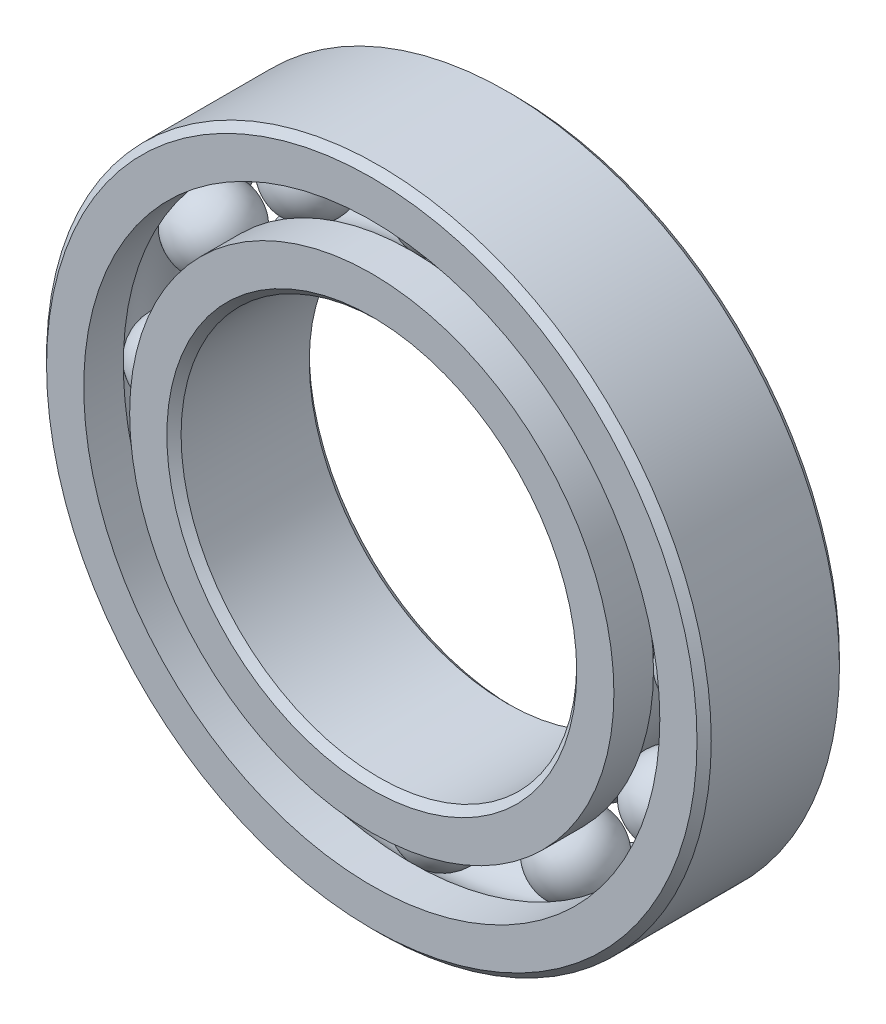
from build123d import *

# Parameters (mm, degrees)
CIRPATTERN1_COUNT = 12


with BuildPart() as part:
    # Sketch1 → Revolve1 (revolve)
    with BuildSketch(Plane(origin=(0, 0, 0), x_dir=(0, 0, -1), z_dir=(1, 0, 0))):
        with BuildLine():
            Line((4.05, 21), (-4.05, 21))
            Line((-4.05, 21), (-4.5, 20.55))
            Line((-4.5, 20.55), (-4.5, 18.200549451))
            Line((-4.5, 18.200549451), (-2, 18.200549451))
            ThreePointArc((-2, 18.200549451), (0, 19.220646415), (2, 18.200549451))
            Line((2, 18.200549451), (4.5, 18.200549451))
            Line((4.5, 18.200549451), (4.5, 20.55))
            Line((4.5, 20.55), (4.05, 21))
        make_face()
    revolve(axis=Axis((0, 0, 4.5), (0, 0, -1)))


with BuildPart() as body_2:
    # Sketch3 → Revolve3 (revolve)
    with BuildSketch(Plane(origin=(0, 0, 0), x_dir=(0, 0, -1), z_dir=(1, 0, 0))):
        with BuildLine():
            Line((-4.5, 15.299450549), (-2, 15.299450549))
            ThreePointArc((-2, 15.299450549), (0, 14.279353585), (2, 15.299450549))
            Line((2, 15.299450549), (4.5, 15.299450549))
            Line((4.5, 15.299450549), (4.5, 12.95))
            Line((4.5, 12.95), (4.05, 12.5))
            Line((4.05, 12.5), (-4.05, 12.5))
            Line((-4.05, 12.5), (-4.5, 12.95))
            Line((-4.5, 12.95), (-4.5, 15.299450549))
        make_face()
    revolve(axis=Axis((0, 0, 4.5), (0, 0, -1)))


with BuildPart() as body_3:
    # Sketch4 → Revolve4 (revolve)
    with BuildSketch(Plane(origin=(0, 0, 0), x_dir=(0, 0, -1), z_dir=(1, 0, 0))):
        with BuildLine():
            Line((-2.470646415, 16.75), (2.470646415, 16.75))
            ThreePointArc((2.470646415, 16.75), (0, 19.220646415), (-2.470646415, 16.75))
        make_face()
    revolve(axis=Axis((0, 16.75, 2.470646415), (0, 0, -1)))


with BuildPart() as cirpattern1_1:
    # CirPattern1: pattern copy
    add(body_3.part.rotate(Axis((0, 0, -4.5), (0, 0, 1)), 1 * 360 / CIRPATTERN1_COUNT))


with BuildPart() as cirpattern1_2:
    # CirPattern1: pattern copy
    add(body_3.part.rotate(Axis((0, 0, -4.5), (0, 0, 1)), 2 * 360 / CIRPATTERN1_COUNT))


with BuildPart() as cirpattern1_3:
    # CirPattern1: pattern copy
    add(body_3.part.rotate(Axis((0, 0, -4.5), (0, 0, 1)), 3 * 360 / CIRPATTERN1_COUNT))


with BuildPart() as cirpattern1_4:
    # CirPattern1: pattern copy
    add(body_3.part.rotate(Axis((0, 0, -4.5), (0, 0, 1)), 4 * 360 / CIRPATTERN1_COUNT))


with BuildPart() as cirpattern1_5:
    # CirPattern1: pattern copy
    add(body_3.part.rotate(Axis((0, 0, -4.5), (0, 0, 1)), 5 * 360 / CIRPATTERN1_COUNT))


with BuildPart() as cirpattern1_6:
    # CirPattern1: pattern copy
    add(body_3.part.rotate(Axis((0, 0, -4.5), (0, 0, 1)), 6 * 360 / CIRPATTERN1_COUNT))


with BuildPart() as cirpattern1_7:
    # CirPattern1: pattern copy
    add(body_3.part.rotate(Axis((0, 0, -4.5), (0, 0, 1)), 7 * 360 / CIRPATTERN1_COUNT))


with BuildPart() as cirpattern1_8:
    # CirPattern1: pattern copy
    add(body_3.part.rotate(Axis((0, 0, -4.5), (0, 0, 1)), 8 * 360 / CIRPATTERN1_COUNT))


with BuildPart() as cirpattern1_9:
    # CirPattern1: pattern copy
    add(body_3.part.rotate(Axis((0, 0, -4.5), (0, 0, 1)), 9 * 360 / CIRPATTERN1_COUNT))


with BuildPart() as cirpattern1_10:
    # CirPattern1: pattern copy
    add(body_3.part.rotate(Axis((0, 0, -4.5), (0, 0, 1)), 10 * 360 / CIRPATTERN1_COUNT))


with BuildPart() as cirpattern1_11:
    # CirPattern1: pattern copy
    add(body_3.part.rotate(Axis((0, 0, -4.5), (0, 0, 1)), 11 * 360 / CIRPATTERN1_COUNT))


solid = Compound([part.part, body_2.part, body_3.part, cirpattern1_1.part, cirpattern1_2.part, cirpattern1_3.part, cirpattern1_4.part, cirpattern1_5.part, cirpattern1_6.part, cirpattern1_7.part, cirpattern1_8.part, cirpattern1_9.part, cirpattern1_10.part, cirpattern1_11.part])
